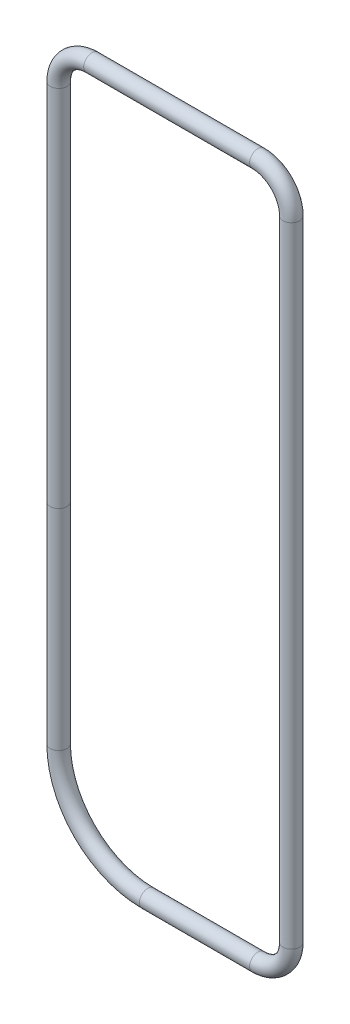
from build123d import *

# Parameters (mm, degrees)
SKETCH5_R = 1.5


with BuildPart() as part:
    # Sweep2: sweep along a path in Sketch4
    with BuildLine(Plane.XY) as sweep2_path:
        Line((-23.236021708, 65.358068893), (-23.236021708, -37.641931107))
        ThreePointArc((-23.236021708, -37.641931107), (-18.549730207, -48.955639606), (-7.236021708, -53.641931107))
        Line((-7.236021708, -53.641931107), (12.563978292, -53.641931107))
        ThreePointArc((12.563978292, -53.641931107), (16.806618979, -51.884571794), (18.563978292, -47.641931107))
        Line((18.563978292, -47.641931107), (18.563978292, 65.358068893))
        ThreePointArc((18.563978292, 65.358068893), (16.806618979, 69.60070958), (12.563978292, 71.358068893))
        Line((12.563978292, 71.358068893), (-17.236021708, 71.358068893))
        ThreePointArc((-17.236021708, 71.358068893), (-21.478662395, 69.60070958), (-23.236021708, 65.358068893))
    # Sketch5 → Sweep2 (sweep)
    with BuildSketch(Plane(origin=(0, 0, 0), x_dir=(1, 0, 0), z_dir=(0, 1, 0))):
        with Locations((-23.236021708, 0)):
            Circle(SKETCH5_R)
    sweep(path=sweep2_path.line)


solid = part.part
